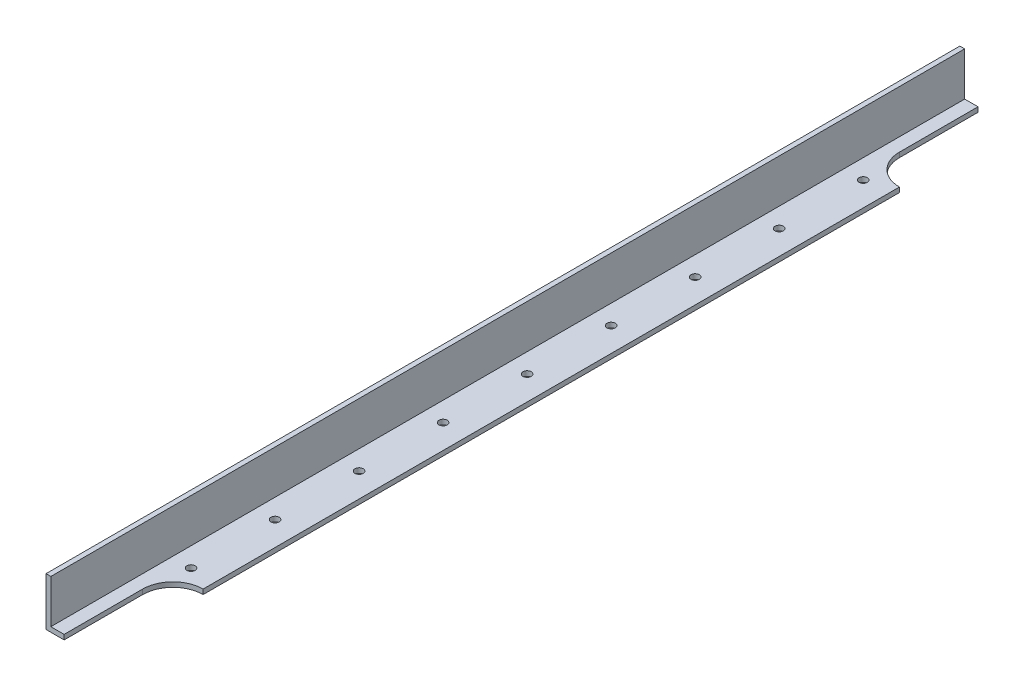
from build123d import *

# Parameters (mm, degrees)
EXTRUDE_1_DEPTH       = 378
CUT_EXTRUDE_1_DEPTH   = 379.956461879
HOLE_WIZARD_M31_D     = 3.4
HOLE_WIZARD_M31_DEPTH = 5
HOLE_WIZARD_M31_TIP   = 1.021463052


with BuildPart() as part:
    # Эскиз1 → Вытянуть-Тонкостенный1 (new body)
    with BuildSketch(Plane.XY):
        Polygon((20, 0), (0, 0), (0, 20), (2, 20), (2, 2), (20, 2), align=None)
    extrude(amount=EXTRUDE_1_DEPTH)

    # Эскиз2 → Вырез-Вытянуть1 (cut, through all)
    with BuildSketch(Plane(origin=(0, 2, 0), x_dir=(1, 0, 0), z_dir=(0, 1, 0))):
        with BuildLine():
            Line((7.5, -378), (7.5, -345.5))
            ThreePointArc((7.5, -345.5), (11.161165235, -336.661165235), (20, -333))
            Line((20, -333), (20, -378))
            Line((20, -378), (7.5, -378))
        make_face()
        with BuildLine():
            Line((20, 0), (7.5, 0))
            Line((7.5, 0), (7.5, -32.5))
            ThreePointArc((7.5, -32.5), (11.161165235, -41.338834765), (20, -45))
            Line((20, -45), (20, 0))
        make_face()
    extrude(amount=-CUT_EXTRUDE_1_DEPTH, mode=Mode.SUBTRACT)

    # Отверстие с зазором M31
    with Locations(Plane.XZ):
        with Locations((10, 50), (10, 84.75), (10, 119.5), (10, 154.25), (10, 189), (10, 223.75), (10, 258.5), (10, 293.25), (10, 328)):
            Hole(HOLE_WIZARD_M31_D / 2, depth=HOLE_WIZARD_M31_DEPTH)
            with Locations((0, 0, -(HOLE_WIZARD_M31_DEPTH + HOLE_WIZARD_M31_TIP / 2))):  # 118° drill point
                Cone(0, HOLE_WIZARD_M31_D / 2, HOLE_WIZARD_M31_TIP, mode=Mode.SUBTRACT)


solid = part.part
